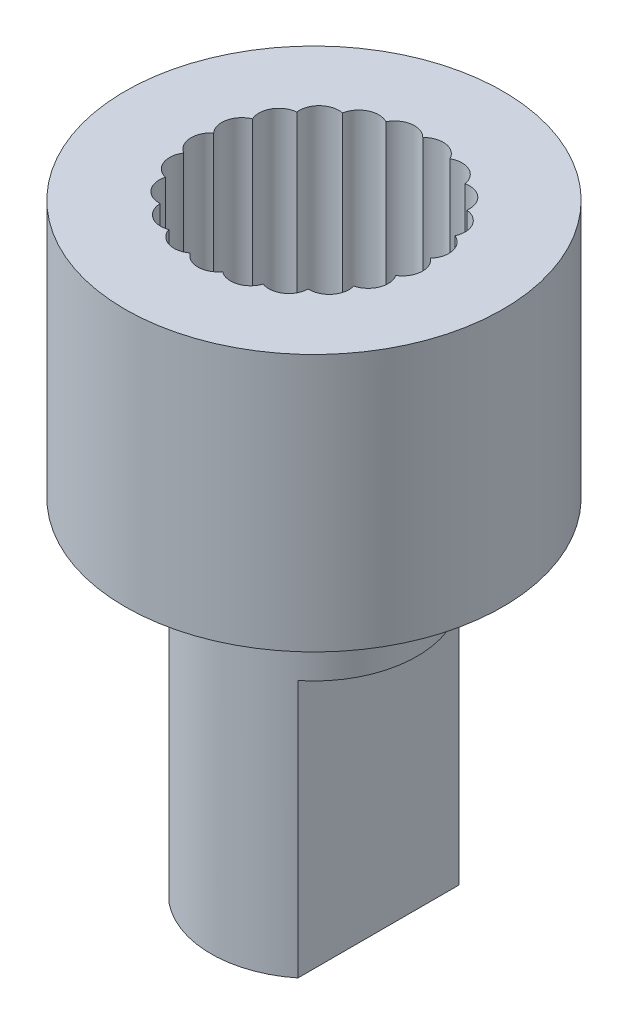
from build123d import *

# Parameters (mm, degrees)
SKETCH1_R           = 3.95
BOSS_EXTRUDE1_DEPTH = 4
SKETCH2_R           = 4.4
BOSS_EXTRUDE2_DEPTH = 2
SKETCH4_R           = 2.4
BOSS_EXTRUDE3_DEPTH = 2
BOSS_EXTRUDE4_DEPTH = 6
SKETCH6_R           = 4.4
SKETCH6_R_2         = 3.95
BOSS_EXTRUDE5_DEPTH = 4
CUT_EXTRUDE1_DEPTH  = 4


with BuildPart() as part:
    # Sketch1 → Boss-Extrude1 (new body)
    with BuildSketch(Plane(origin=(0, 0, 0), x_dir=(1, 0, 0), z_dir=(0, 1, 0))):
        with Locations(Location((0, 0, 0), (0, 0, 270))):
            Circle(SKETCH1_R)
        with BuildLine():
            ThreePointArc((-0.166646614, 2.345141313), (-0.092401566, 2.286261662), (0, 2.2652595))
            ThreePointArc((0, 2.2652595), (0.092401566, 2.286261662), (0.166646614, 2.345141313))
            ThreePointArc((0.166646614, 2.345141313), (0.365153552, 2.422635524), (0.531999564, 2.290073216))
            ThreePointArc((0.531999564, 2.290073216), (0.585591031, 2.211925311), (0.667696959, 2.164620376))
            ThreePointArc((0.667696959, 2.164620376), (0.762183879, 2.157453631), (0.850485509, 2.191833312))
            ThreePointArc((0.850485509, 2.191833312), (1.063015161, 2.207373726), (1.183375246, 2.031522064))
            ThreePointArc((1.183375246, 2.031522064), (1.211551295, 1.941049689), (1.276066113, 1.871645232))
            ThreePointArc((1.276066113, 1.871645232), (1.364242809, 1.836946378), (1.458755034, 1.843771303))
            ThreePointArc((1.458755034, 1.843771303), (1.666423208, 1.795977086), (1.729602845, 1.592461261))
            ThreePointArc((1.729602845, 1.592461261), (1.72985991, 1.497703284), (1.771051193, 1.412366197))
            ThreePointArc((1.771051193, 1.412366197), (1.845082779, 1.353218377), (1.937407773, 1.331882123))
            ThreePointArc((1.937407773, 1.331882123), (2.121762239, 1.225), (2.12214764, 1.011903287))
            ThreePointArc((2.12214764, 1.011903287), (2.094462881, 0.92127937), (2.108670602, 0.827592226))
            ThreePointArc((2.108670602, 0.827592226), (2.161979047, 0.749250985), (2.243913329, 0.701649371))
            ThreePointArc((2.243913329, 0.701649371), (2.388573385, 0.545176288), (2.326130305, 0.341433266))
            ThreePointArc((2.326130305, 0.341433266), (2.272963633, 0.262995741), (2.258925375, 0.169283054))
            ThreePointArc((2.258925375, 0.169283054), (2.286773988, 0.078709355), (2.351037339, 0.009071994))
            ThreePointArc((2.351037339, 0.009071994), (2.443149303, -0.183088729), (2.323426084, -0.3593746))
            ThreePointArc((2.323426084, -0.3593746), (2.249501592, -0.418656214), (2.208464714, -0.504067659))
            ThreePointArc((2.208464714, -0.504067659), (2.208379026, -0.598825947), (2.249261363, -0.68431147))
            ThreePointArc((2.249261363, -0.68431147), (2.280640684, -0.89508551), (2.114275259, -1.028250455))
            ThreePointArc((2.114275259, -1.028250455), (2.026161462, -1.063108727), (1.961772273, -1.13262975))
            ThreePointArc((1.961772273, -1.13262975), (1.933759896, -1.223152935), (1.947628645, -1.316890857))
            ThreePointArc((1.947628645, -1.316890857), (1.915487132, -1.527550015), (1.717261799, -1.605761745))
            ThreePointArc((1.717261799, -1.605761745), (1.622787995, -1.613099364), (1.540767756, -1.660552716))
            ThreePointArc((1.540767756, -1.660552716), (1.487317713, -1.738797417), (1.472940575, -1.832458712))
            ThreePointArc((1.472940575, -1.832458712), (1.380134142, -2.024284997), (1.167662092, -2.040594058))
            ThreePointArc((1.167662092, -2.040594058), (1.075222693, -2.019759044), (0.982859262, -2.040928287))
            ThreePointArc((0.982859262, -2.040928287), (0.908720824, -2.099942118), (0.86737527, -2.185204569))
            ThreePointArc((0.86737527, -2.185204569), (0.722150177, -2.341153374), (0.514310485, -2.294110633))
            ThreePointArc((0.514310485, -2.294110633), (0.432119136, -2.246954269), (0.337619409, -2.239958423))
            ThreePointArc((0.337619409, -2.239958423), (0.249380102, -2.274497747), (0.184739867, -2.343785411))
            ThreePointArc((0.184739867, -2.343785411), (0, -2.45), (-0.184739867, -2.343785411))
            ThreePointArc((-0.184739867, -2.343785411), (-0.249380102, -2.274497747), (-0.337619409, -2.239958423))
            ThreePointArc((-0.337619409, -2.239958423), (-0.432119136, -2.246954269), (-0.514310485, -2.294110633))
            ThreePointArc((-0.514310485, -2.294110633), (-0.722150177, -2.341153374), (-0.86737527, -2.185204569))
            ThreePointArc((-0.86737527, -2.185204569), (-0.908720824, -2.099942118), (-0.982859262, -2.040928287))
            ThreePointArc((-0.982859262, -2.040928287), (-1.075222693, -2.019759044), (-1.167662092, -2.040594058))
            ThreePointArc((-1.167662092, -2.040594058), (-1.380134142, -2.024284997), (-1.472940575, -1.832458712))
            ThreePointArc((-1.472940575, -1.832458712), (-1.487317713, -1.738797417), (-1.540767756, -1.660552716))
            ThreePointArc((-1.540767756, -1.660552716), (-1.622787995, -1.613099364), (-1.717261799, -1.605761745))
            ThreePointArc((-1.717261799, -1.605761745), (-1.915487132, -1.527550015), (-1.947628645, -1.316890857))
            ThreePointArc((-1.947628645, -1.316890857), (-1.933759896, -1.223152935), (-1.961772273, -1.13262975))
            ThreePointArc((-1.961772273, -1.13262975), (-2.026161462, -1.063108727), (-2.114275259, -1.028250455))
            ThreePointArc((-2.114275259, -1.028250455), (-2.280640684, -0.89508551), (-2.249261363, -0.68431147))
            ThreePointArc((-2.249261363, -0.68431147), (-2.208379026, -0.598825947), (-2.208464714, -0.504067659))
            ThreePointArc((-2.208464714, -0.504067659), (-2.249501592, -0.418656214), (-2.323426084, -0.3593746))
            ThreePointArc((-2.323426084, -0.3593746), (-2.443149303, -0.183088729), (-2.351037339, 0.009071994))
            ThreePointArc((-2.351037339, 0.009071994), (-2.286773988, 0.078709355), (-2.258925375, 0.169283054))
            ThreePointArc((-2.258925375, 0.169283054), (-2.272963633, 0.262995741), (-2.326130305, 0.341433266))
            ThreePointArc((-2.326130305, 0.341433266), (-2.388573385, 0.545176288), (-2.243913329, 0.701649371))
            ThreePointArc((-2.243913329, 0.701649371), (-2.161979047, 0.749250985), (-2.108670602, 0.827592226))
            ThreePointArc((-2.108670602, 0.827592226), (-2.094462881, 0.92127937), (-2.12214764, 1.011903287))
            ThreePointArc((-2.12214764, 1.011903287), (-2.121762239, 1.225), (-1.937407773, 1.331882123))
            ThreePointArc((-1.937407773, 1.331882123), (-1.845082779, 1.353218377), (-1.771051193, 1.412366197))
            ThreePointArc((-1.771051193, 1.412366197), (-1.72985991, 1.497703284), (-1.729602845, 1.592461261))
            ThreePointArc((-1.729602845, 1.592461261), (-1.666423208, 1.795977086), (-1.458755034, 1.843771303))
            ThreePointArc((-1.458755034, 1.843771303), (-1.364242809, 1.836946378), (-1.276066113, 1.871645232))
            ThreePointArc((-1.276066113, 1.871645232), (-1.211551295, 1.941049689), (-1.183375246, 2.031522064))
            ThreePointArc((-1.183375246, 2.031522064), (-1.063015161, 2.207373726), (-0.850485509, 2.191833312))
            ThreePointArc((-0.850485509, 2.191833312), (-0.762183879, 2.157453631), (-0.667696959, 2.164620376))
            ThreePointArc((-0.667696959, 2.164620376), (-0.585591031, 2.211925311), (-0.531999564, 2.290073216))
            ThreePointArc((-0.531999564, 2.290073216), (-0.365153552, 2.422635524), (-0.166646614, 2.345141313))
        make_face(mode=Mode.SUBTRACT)
    extrude(amount=BOSS_EXTRUDE1_DEPTH)

    # Sketch2 → Boss-Extrude2 (add)
    with BuildSketch(Plane.XZ):
        with Locations(Location((0, 0, 0), (0, 0, 270))):
            Circle(SKETCH2_R)
    extrude(amount=BOSS_EXTRUDE2_DEPTH)

    # Sketch4 → Boss-Extrude3 (add)
    with BuildSketch(Plane.XZ.offset(2)):
        with Locations(Location((0, 0, 0), (0, 0, 270))):
            Circle(SKETCH4_R)
    extrude(amount=BOSS_EXTRUDE3_DEPTH)

    # Sketch5 → Boss-Extrude4 (add)
    with BuildSketch(Plane.XZ.offset(4)):
        with BuildLine():
            ThreePointArc((1.5, 1.8734994), (0, 2.4), (-1.5, 1.8734994))
            Line((-1.5, 1.8734994), (-1.5, -1.8734994))
            ThreePointArc((-1.5, -1.8734994), (0, -2.4), (1.5, -1.8734994))
            Line((1.5, -1.8734994), (1.5, 1.8734994))
        make_face()
    extrude(amount=BOSS_EXTRUDE4_DEPTH)

    # Sketch6 → Boss-Extrude5 (add)
    with BuildSketch(Plane(origin=(0, 0, 0), x_dir=(1, 0, 0), z_dir=(0, 1, 0))):
        with Locations(Location((0, 0, 0), (0, 0, 270))):
            Circle(SKETCH6_R)
        Circle(SKETCH6_R_2, mode=Mode.SUBTRACT)
    extrude(amount=BOSS_EXTRUDE5_DEPTH)

    # Sketch8 → Cut-Extrude1 (cut)
    with BuildSketch(Plane(origin=(0, 4, 0), x_dir=(1, 0, 0), z_dir=(0, 1, 0))):
        with BuildLine():
            ThreePointArc((0.746832801, 2.421172474), (0.402414119, 2.669843231), (0, 2.533739407))
            ThreePointArc((0, 2.533739407), (-0.402414119, 2.669843231), (-0.746832801, 2.421172474))
            ThreePointArc((-0.746832801, 2.421172474), (-1.171486096, 2.432615943), (-1.42730623, 2.093473742))
            ThreePointArc((-1.42730623, 2.093473742), (-1.836466392, 1.979240054), (-1.980957237, 1.579760681))
            ThreePointArc((-1.980957237, 1.579760681), (-2.33826859, 1.35), (-2.3585915, 0.92567895))
            ThreePointArc((-2.3585915, 0.92567895), (-2.632305363, 0.600806522), (-2.526654558, 0.189346583))
            ThreePointArc((-2.526654558, 0.189346583), (-2.692450252, -0.201771253), (-2.47021327, -0.563810059))
            ThreePointArc((-2.47021327, -0.563810059), (-2.513359121, -0.986420766), (-2.194282693, -1.266869704))
            ThreePointArc((-2.194282693, -1.266869704), (-2.110945003, -1.683422465), (-1.723380469, -1.857362415))
            ThreePointArc((-1.723380469, -1.857362415), (-1.520964157, -2.230844691), (-1.099348328, -2.282820325))
            ThreePointArc((-1.099348328, -2.282820325), (-0.795838971, -2.580046576), (-0.377634263, -2.505439631))
            ThreePointArc((-0.377634263, -2.505439631), (0, -2.7), (0.377634263, -2.505439631))
            ThreePointArc((0.377634263, -2.505439631), (0.795838971, -2.580046576), (1.099348328, -2.282820325))
            ThreePointArc((1.099348328, -2.282820325), (1.520964157, -2.230844691), (1.723380469, -1.857362415))
            ThreePointArc((1.723380469, -1.857362415), (2.110945003, -1.683422465), (2.194282693, -1.266869704))
            ThreePointArc((2.194282693, -1.266869704), (2.513359121, -0.986420766), (2.47021327, -0.563810059))
            ThreePointArc((2.47021327, -0.563810059), (2.692450252, -0.201771253), (2.526654558, 0.189346583))
            ThreePointArc((2.526654558, 0.189346583), (2.632305363, 0.600806522), (2.3585915, 0.92567895))
            ThreePointArc((2.3585915, 0.92567895), (2.33826859, 1.35), (1.980957237, 1.579760681))
            ThreePointArc((1.980957237, 1.579760681), (1.836466392, 1.979240054), (1.42730623, 2.093473742))
            ThreePointArc((1.42730623, 2.093473742), (1.171486096, 2.432615943), (0.746832801, 2.421172474))
        make_face()
    extrude(amount=-CUT_EXTRUDE1_DEPTH, mode=Mode.SUBTRACT)


solid = part.part
